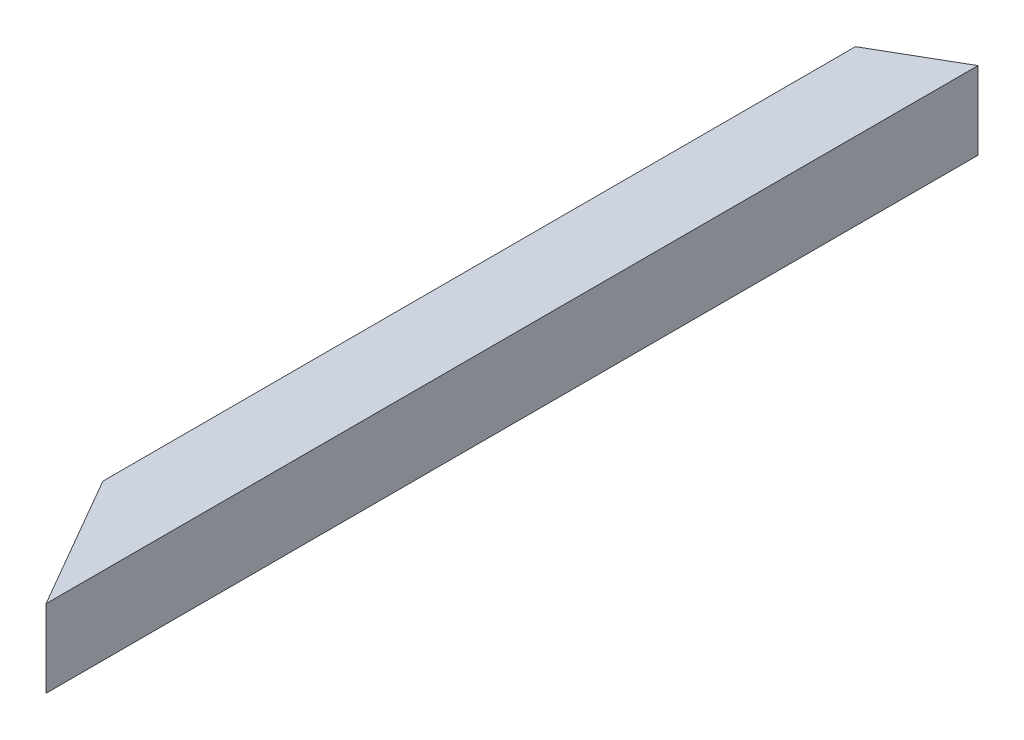
from build123d import *

# Parameters (mm, degrees)
SKETCH_1_W          = 20
SKETCH_1_H          = 20
SKETCH_1_W_2        = 18
SKETCH_1_H_2        = 18
EXTRUDE_1_DEPTH     = 240
CUT_EXTRUDE_1_DEPTH = 300


with BuildPart() as part:
    # 草图1 → 凸台-拉伸1 (new body)
    with BuildSketch(Plane.XY):
        with Locations((10, 10)):
            Rectangle(SKETCH_1_W, SKETCH_1_H)
        with Locations((10, 10)):
            Rectangle(SKETCH_1_W_2, SKETCH_1_H_2, mode=Mode.SUBTRACT)
    extrude(amount=EXTRUDE_1_DEPTH)

    # 草图2 → 切除-拉伸1 (cut)
    with BuildSketch(Plane(origin=(0, 20, 0), x_dir=(1, 0, 0), z_dir=(0, 1, 0))):
        Polygon((20, 0), (0, -11.547005384), (0, 0), align=None)
        Polygon((0, -205.358983849), (20, -240), (0, -240), align=None)
    extrude(amount=-CUT_EXTRUDE_1_DEPTH, mode=Mode.SUBTRACT)


solid = part.part
